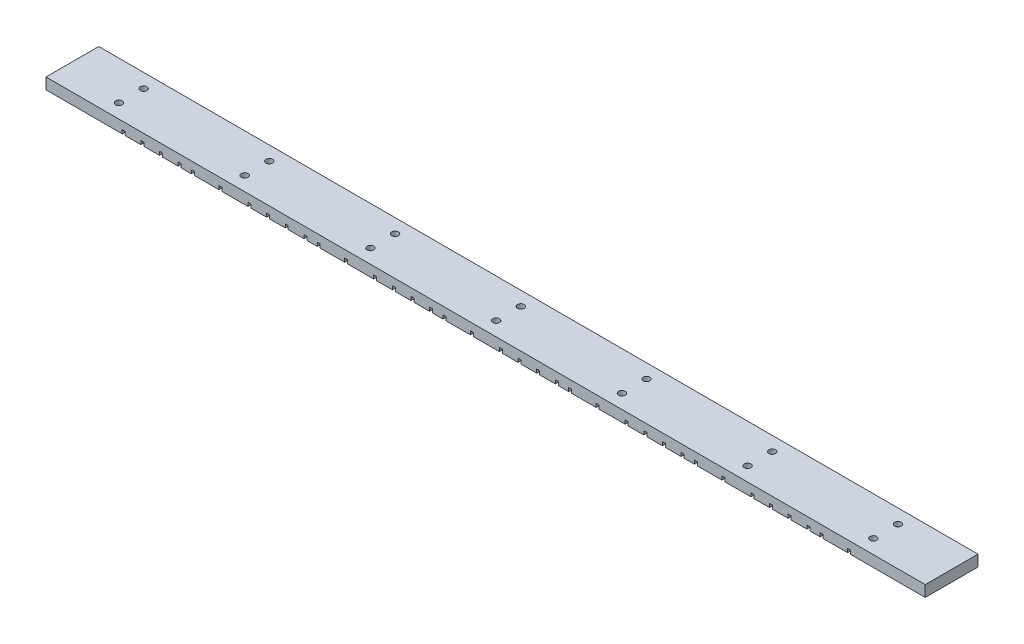
from build123d import *

# Parameters (mm, degrees)
SKETCH2_W           = 500
SKETCH2_H           = 30
BOSS_EXTRUDE1_DEPTH = 6.35
SKETCH3_R           = 3.175
CUT_EXTRUDE1_DEPTH  = 3
CUT_EXTRUDE2_DEPTH  = 415.474272422
SKETCH6_R           = 1.89865
CUT_EXTRUDE3_DEPTH  = 404.162898219


with BuildPart() as part:
    # Sketch2 → Boss-Extrude1 (new body)
    with BuildSketch(Plane(origin=(0, 98, 0), x_dir=(1, 0, 0), z_dir=(0, 1, 0))):
        with Locations((150, 35)):
            Rectangle(SKETCH2_W, SKETCH2_H)
    extrude(amount=BOSS_EXTRUDE1_DEPTH)

    # Sketch3 → Cut-Extrude1 (cut)
    with BuildSketch(Plane(origin=(0, 98, 0), x_dir=(1, 0, 0), z_dir=(0, 1, 0))):
        with Locations(Location((362.5, 42, 0), (0, 0, 180))):
            Circle(SKETCH3_R)
        with Locations(Location((362.5, 28, 0), (0, 0, 180))):
            Circle(SKETCH3_R)
        with Locations(Location((291, 42, 0), (0, 0, 180))):
            Circle(SKETCH3_R)
        with Locations(Location((291, 28, 0), (0, 0, 180))):
            Circle(SKETCH3_R)
        with Locations(Location((219.5, 42, 0), (0, 0, 180))):
            Circle(SKETCH3_R)
        with Locations(Location((219.5, 28, 0), (0, 0, 180))):
            Circle(SKETCH3_R)
        with Locations(Location((148, 42, 0), (0, 0, 180))):
            Circle(SKETCH3_R)
        with Locations(Location((148, 28, 0), (0, 0, 180))):
            Circle(SKETCH3_R)
        with Locations(Location((76.5, 42, 0), (0, 0, 180))):
            Circle(SKETCH3_R)
        with Locations(Location((76.5, 28, 0), (0, 0, 180))):
            Circle(SKETCH3_R)
        with Locations(Location((5, 42, 0), (0, 0, 180))):
            Circle(SKETCH3_R)
        with Locations(Location((5, 28, 0), (0, 0, 180))):
            Circle(SKETCH3_R)
        with Locations(Location((-66.5, 42, 0), (0, 0, 180))):
            Circle(SKETCH3_R)
        with Locations(Location((-66.5, 28, 0), (0, 0, 180))):
            Circle(SKETCH3_R)
    extrude(amount=CUT_EXTRUDE1_DEPTH, mode=Mode.SUBTRACT)

    # Sketch5 → Cut-Extrude2 (cut, through all)
    with BuildSketch(Plane(origin=(0, 0, -50), x_dir=(-1, 0, 0), z_dir=(0, 0, -1))):
        Polygon((-357.55715, 98), (-357.55715, 100.05715), (-355.85535, 100.05715), (-355.85535, 98), (-341.95715, 98), (-341.95715, 100.05715), (-340.25535, 100.05715), (-340.25535, 98), (-334.35715, 98), (-334.35715, 100.05715), (-332.65535, 100.05715), (-332.65535, 98), (-323.75715, 98), (-323.75715, 100.05715), (-322.05535, 100.05715), (-322.05535, 98), (-313.15715, 98), (-313.15715, 100.05715), (-311.45535, 100.05715), (-311.45535, 98), (-302.55715, 98), (-302.55715, 100.05715), (-300.85535, 100.05715), (-300.85535, 98), (-295.78949815, 98), (-295.78949815, 96.633226224), (-359.074689679, 96.633226224), (-359.074689679, 98), align=None)
        Polygon((-286.05715, 98), (-286.05715, 100.05715), (-284.35535, 100.05715), (-284.35535, 98), (-270.45715, 98), (-270.45715, 100.05715), (-268.75535, 100.05715), (-268.75535, 98), (-262.85715, 98), (-262.85715, 100.05715), (-261.15535, 100.05715), (-261.15535, 98), (-252.25715, 98), (-252.25715, 100.05715), (-250.55535, 100.05715), (-250.55535, 98), (-241.65715, 98), (-241.65715, 100.05715), (-239.95535, 100.05715), (-239.95535, 98), (-231.05715, 98), (-231.05715, 100.05715), (-229.35535, 100.05715), (-229.35535, 98), (-224.28949815, 98), (-224.28949815, 96.633226224), (-287.574689679, 96.633226224), (-287.574689679, 98), align=None)
        Polygon((-214.55715, 98), (-214.55715, 100.05715), (-212.85535, 100.05715), (-212.85535, 98), (-198.95715, 98), (-198.95715, 100.05715), (-197.25535, 100.05715), (-197.25535, 98), (-191.35715, 98), (-191.35715, 100.05715), (-189.65535, 100.05715), (-189.65535, 98), (-180.75715, 98), (-180.75715, 100.05715), (-179.05535, 100.05715), (-179.05535, 98), (-170.15715, 98), (-170.15715, 100.05715), (-168.45535, 100.05715), (-168.45535, 98), (-159.55715, 98), (-159.55715, 100.05715), (-157.85535, 100.05715), (-157.85535, 98), (-152.78949815, 98), (-152.78949815, 96.633226224), (-216.074689679, 96.633226224), (-216.074689679, 98), align=None)
        Polygon((-143.05715, 98), (-143.05715, 100.05715), (-141.35535, 100.05715), (-141.35535, 98), (-127.45715, 98), (-127.45715, 100.05715), (-125.75535, 100.05715), (-125.75535, 98), (-119.85715, 98), (-119.85715, 100.05715), (-118.15535, 100.05715), (-118.15535, 98), (-109.25715, 98), (-109.25715, 100.05715), (-107.55535, 100.05715), (-107.55535, 98), (-98.65715, 98), (-98.65715, 100.05715), (-96.95535, 100.05715), (-96.95535, 98), (-88.05715, 98), (-88.05715, 100.05715), (-86.35535, 100.05715), (-86.35535, 98), (-81.28949815, 98), (-81.28949815, 96.633226224), (-144.574689679, 96.633226224), (-144.574689679, 98), align=None)
        Polygon((-71.55715, 98), (-71.55715, 100.05715), (-69.85535, 100.05715), (-69.85535, 98), (-55.95715, 98), (-55.95715, 100.05715), (-54.25535, 100.05715), (-54.25535, 98), (-48.35715, 98), (-48.35715, 100.05715), (-46.65535, 100.05715), (-46.65535, 98), (-37.75715, 98), (-37.75715, 100.05715), (-36.05535, 100.05715), (-36.05535, 98), (-27.15715, 98), (-27.15715, 100.05715), (-25.45535, 100.05715), (-25.45535, 98), (-16.55715, 98), (-16.55715, 100.05715), (-14.85535, 100.05715), (-14.85535, 98), (-9.78949815, 98), (-9.78949815, 96.633226224), (-73.074689679, 96.633226224), (-73.074689679, 98), align=None)
        Polygon((-0.05715, 98), (-0.05715, 100.05715), (1.64465, 100.05715), (1.64465, 98), (15.54285, 98), (15.54285, 100.05715), (17.24465, 100.05715), (17.24465, 98), (23.14285, 98), (23.14285, 100.05715), (24.84465, 100.05715), (24.84465, 98), (33.74285, 98), (33.74285, 100.05715), (35.44465, 100.05715), (35.44465, 98), (44.34285, 98), (44.34285, 100.05715), (46.04465, 100.05715), (46.04465, 98), (54.94285, 98), (54.94285, 100.05715), (56.64465, 100.05715), (56.64465, 98), (61.71050185, 98), (61.71050185, 96.633226224), (-1.574689679, 96.633226224), (-1.574689679, 98), align=None)
    extrude(amount=-CUT_EXTRUDE2_DEPTH, mode=Mode.SUBTRACT)

    # Sketch6 → Cut-Extrude3 (cut, through all)
    with BuildSketch(Plane(origin=(0, 104.35, 0), x_dir=(1, 0, 0), z_dir=(0, 1, 0))):
        with Locations(Location((-66.5, 28, 0), (0, 0, 180))):
            Circle(SKETCH6_R)
        with Locations(Location((-66.5, 42, 0), (0, 0, 180))):
            Circle(SKETCH6_R)
        with Locations(Location((5, 28, 0), (0, 0, 180))):
            Circle(SKETCH6_R)
        with Locations(Location((5, 42, 0), (0, 0, 180))):
            Circle(SKETCH6_R)
        with Locations(Location((76.5, 28, 0), (0, 0, 180))):
            Circle(SKETCH6_R)
        with Locations(Location((76.5, 42, 0), (0, 0, 180))):
            Circle(SKETCH6_R)
        with Locations(Location((148, 28, 0), (0, 0, 180))):
            Circle(SKETCH6_R)
        with Locations(Location((148, 42, 0), (0, 0, 180))):
            Circle(SKETCH6_R)
        with Locations(Location((219.5, 28, 0), (0, 0, 180))):
            Circle(SKETCH6_R)
        with Locations(Location((219.5, 42, 0), (0, 0, 180))):
            Circle(SKETCH6_R)
        with Locations(Location((291, 28, 0), (0, 0, 180))):
            Circle(SKETCH6_R)
        with Locations(Location((291, 42, 0), (0, 0, 180))):
            Circle(SKETCH6_R)
        with Locations(Location((362.5, 28, 0), (0, 0, 180))):
            Circle(SKETCH6_R)
        with Locations(Location((362.5, 42, 0), (0, 0, 180))):
            Circle(SKETCH6_R)
    extrude(amount=-CUT_EXTRUDE3_DEPTH, mode=Mode.SUBTRACT)


solid = part.part
